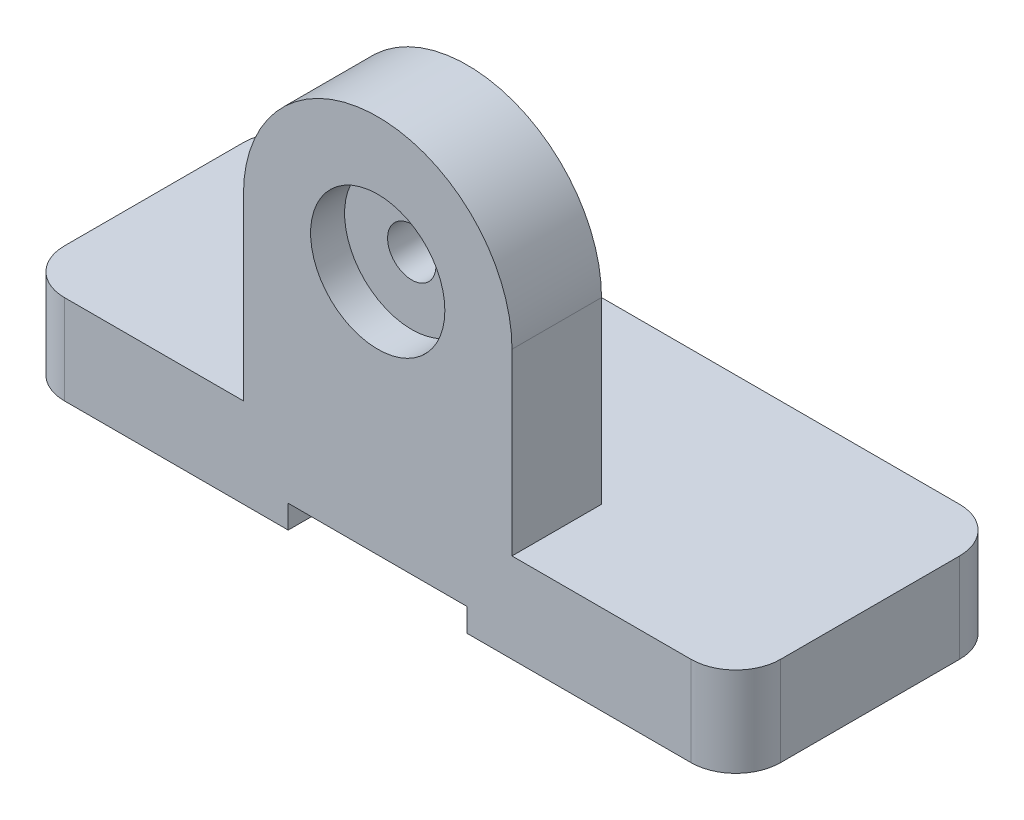
from build123d import *

# Parameters (mm, degrees)
SKETCH2_W                                       = 101.6
SKETCH2_H                                       = 38.1
BOSS_EXTRUDE1_DEPTH                             = 12.7
SKETCH3_W                                       = 25.4
SKETCH3_H                                       = 3.302
CUT_EXTRUDE1_DEPTH                              = 65.757547823
BOSS_EXTRUDE2_DEPTH                             = 12.7
CBORE_FOR_0_PAN_HEAD_MACHINE_SCREW1_D           = 6.858
CBORE_FOR_0_PAN_HEAD_MACHINE_SCREW1_CBORE_D     = 19.05
CBORE_FOR_0_PAN_HEAD_MACHINE_SCREW1_CBORE_DEPTH = 4.826
FILLET1_R                                       = 6.35


with BuildPart() as part:
    # Sketch2 → Boss-Extrude1 (new body)
    with BuildSketch(Plane(origin=(0, 0, 0), x_dir=(1, 0, 0), z_dir=(0, 1, 0))):
        Rectangle(SKETCH2_W, SKETCH2_H)
    extrude(amount=BOSS_EXTRUDE1_DEPTH)

    # Sketch3 → Cut-Extrude1 (cut, through all)
    with BuildSketch(Plane.XY.offset(19.05)):
        with Locations((0, 1.651)):
            Rectangle(SKETCH3_W, SKETCH3_H)
    extrude(amount=-CUT_EXTRUDE1_DEPTH, mode=Mode.SUBTRACT)

    # Sketch5 → Boss-Extrude2 (add)
    with BuildSketch(Plane.XY.offset(19.05)):
        with BuildLine():
            Line((-19.05, 12.7), (19.05, 12.7))
            Line((19.05, 12.7), (19.05, 38.1))
            ThreePointArc((19.05, 38.1), (0, 57.15), (-19.05, 38.1))
            Line((-19.05, 38.1), (-19.05, 12.7))
        make_face()
    extrude(amount=-BOSS_EXTRUDE2_DEPTH)

    # CBORE for #0 Pan Head Machine Screw1 (through all)
    with Locations(Plane.XY.offset(19.05)):
        with Locations((0, 38.1)):
            CounterBoreHole(CBORE_FOR_0_PAN_HEAD_MACHINE_SCREW1_D / 2, CBORE_FOR_0_PAN_HEAD_MACHINE_SCREW1_CBORE_D / 2, CBORE_FOR_0_PAN_HEAD_MACHINE_SCREW1_CBORE_DEPTH)

    # Fillet1
    fillet1_edges = [part.edges().sort_by_distance(p)[0] for p in [
        (-50.8, 6.35, -19.05),
        (50.8, 6.35, -19.05),
        (50.8, 6.35, 19.05),
        (-50.8, 6.35, 19.05),
    ]]
    fillet(fillet1_edges, radius=FILLET1_R)


solid = part.part
